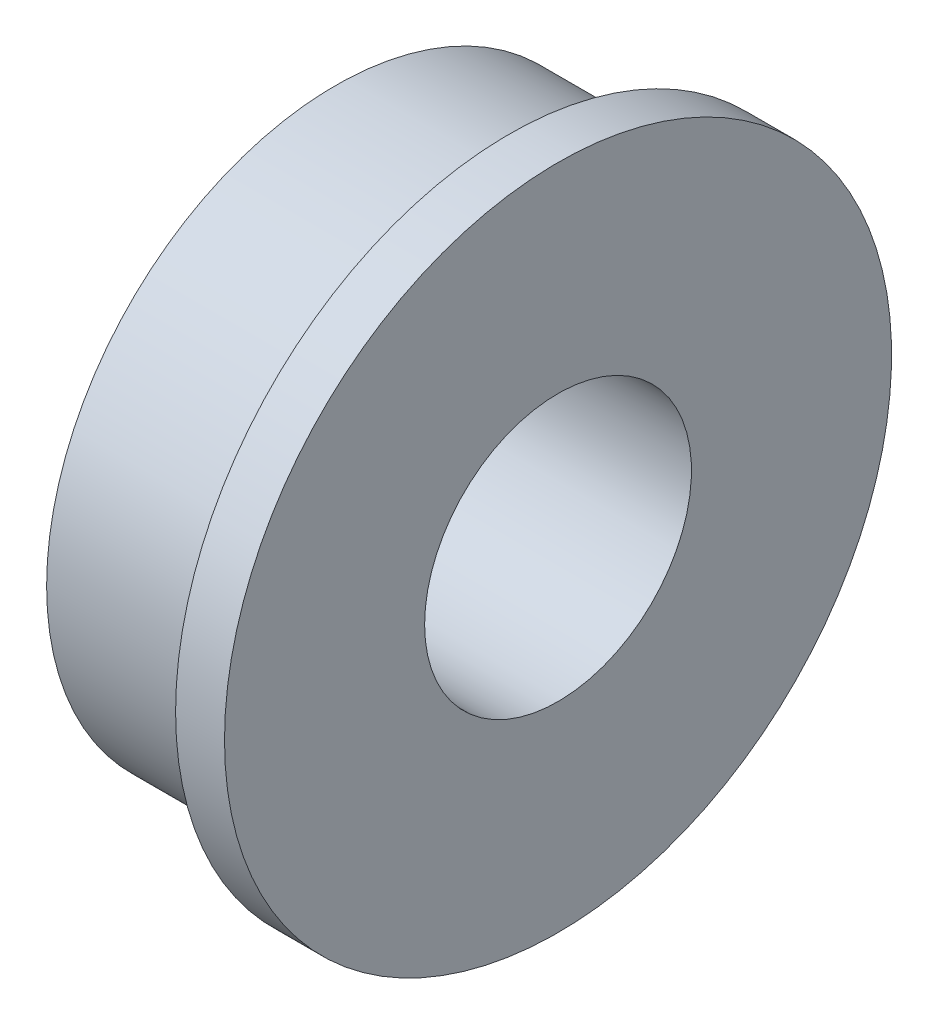
from build123d import *


with BuildPart() as part:
    # 草图1 → 旋转1 (revolve)
    with BuildSketch(Plane.XY, mode=Mode.PRIVATE) as revolve_1_sk:
        Polygon((0, 7.5), (0, 3), (-5, 3), (-5, 6.5), (-1.1, 6.5), (-1.1, 7.5), align=None)
    revolve(revolve_1_sk.sketch.rotate(Axis((-46.864864865, 0, 0), (1, 0, 0)), 90), axis=Axis((-46.864864865, 0, 0), (1, 0, 0)))


solid = part.part
